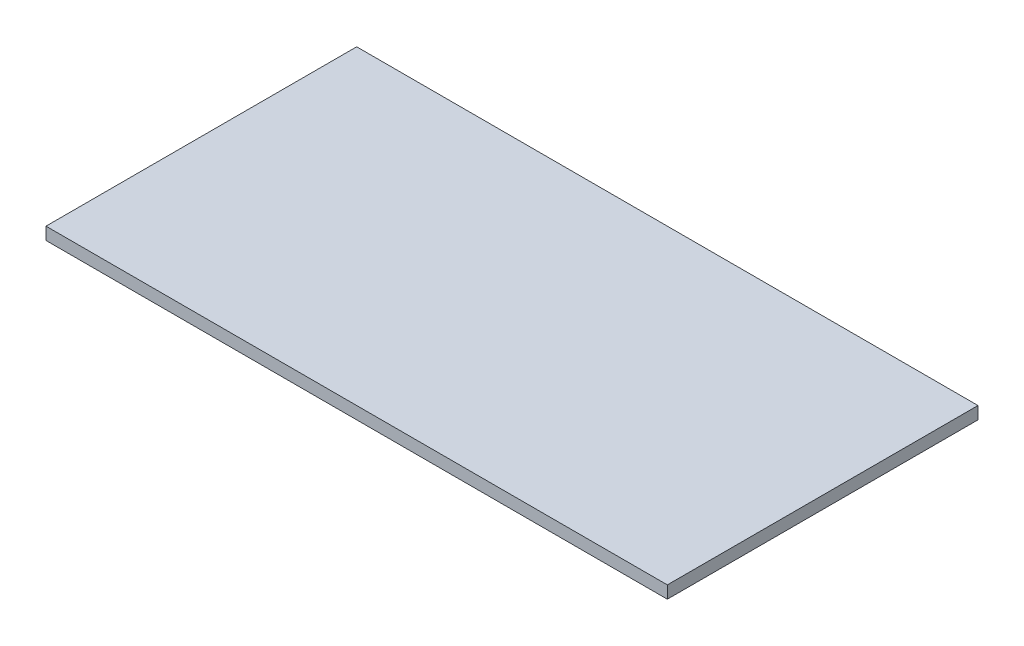
from build123d import *

# Parameters (mm, degrees)
SKETCH1_W           = 200
SKETCH1_H           = 100
BOSS_EXTRUDE1_DEPTH = 4


with BuildPart() as part:
    # Sketch1 → Boss-Extrude1 (new body)
    with BuildSketch(Plane(origin=(0, 0, 0), x_dir=(1, 0, 0), z_dir=(0, 1, 0))):
        with Locations((100, 50)):
            Rectangle(SKETCH1_W, SKETCH1_H)
    extrude(amount=BOSS_EXTRUDE1_DEPTH)


solid = part.part
